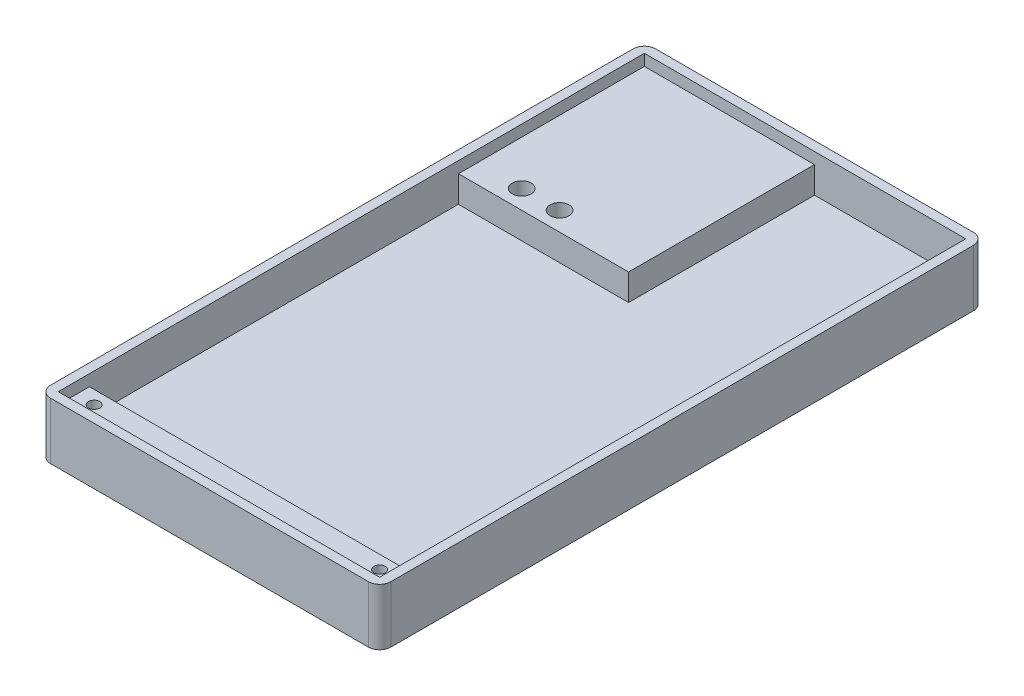
from build123d import *

# Parameters (mm, degrees)
SKETCH1_W           = 90
SKETCH1_H           = 160
BOSS_EXTRUDE1_DEPTH = 5
SKETCH2_W           = 90
SKETCH2_H           = 160
SKETCH2_W_2         = 85
SKETCH2_H_2         = 155
BOSS_EXTRUDE2_DEPTH = 10
SKETCH3_W           = 85
SKETCH3_H           = 8.25
SKETCH3_R           = 1.5
BOSS_EXTRUDE3_DEPTH = 7
SKETCH4_W           = 45
SKETCH4_H           = 39.175
SKETCH4_H_2         = 10
SKETCH4_R           = 2.5
BOSS_EXTRUDE4_DEPTH = 7
FILLET1_R           = 3
SKETCH5_R           = 2.5
SKETCH5_R_2         = 2.55926668
SKETCH5_R_3         = 1.5
CUT_EXTRUDE1_DEPTH  = 119.276665608


with BuildPart() as part:
    # Sketch1 → Boss-Extrude1 (new body)
    with BuildSketch(Plane(origin=(0, 0, 0), x_dir=(1, 0, 0), z_dir=(0, 1, 0))):
        with Locations((1.726862302, -28.194130926)):
            Rectangle(SKETCH1_W, SKETCH1_H)
    extrude(amount=BOSS_EXTRUDE1_DEPTH)

    # Sketch2 → Boss-Extrude2 (add)
    with BuildSketch(Plane(origin=(0, 5, 0), x_dir=(1, 0, 0), z_dir=(0, 1, 0))):
        with Locations((1.726862302, -28.194130926)):
            Rectangle(SKETCH2_W, SKETCH2_H)
        with Locations((1.726862302, -28.194130926)):
            Rectangle(SKETCH2_W_2, SKETCH2_H_2, mode=Mode.SUBTRACT)
    extrude(amount=BOSS_EXTRUDE2_DEPTH)

    # Sketch3 → Boss-Extrude3 (add)
    with BuildSketch(Plane(origin=(0, 5, 0), x_dir=(1, 0, 0), z_dir=(0, 1, 0))):
        with Locations((1.726862302, -101.569130926)):
            Rectangle(SKETCH3_W, SKETCH3_H)
        with Locations(Location((-36.023137698, -100.944130926, 0), (0, 0, 270))):
            Circle(SKETCH3_R, mode=Mode.SUBTRACT)
        with Locations(Location((39.476862302, -100.944130926, 0), (0, 0, 270))):
            Circle(SKETCH3_R, mode=Mode.SUBTRACT)
    extrude(amount=BOSS_EXTRUDE3_DEPTH)

    # Sketch4 → Boss-Extrude4 (add)
    # profile 1 of 2: a face of its own
    with BuildSketch(Plane(origin=(0, 5, 0), x_dir=(1, 0, 0), z_dir=(0, 1, 0))):
        with Locations((-18.273137698, 29.718369074)):
            Rectangle(SKETCH4_W, SKETCH4_H)
    # profile 2 of 2: a face of its own
    with BuildSketch(Plane(origin=(0, 5, 0), x_dir=(1, 0, 0), z_dir=(0, 1, 0))):
        with Locations((-18.273137698, 5.130869074)):
            Rectangle(SKETCH4_W, SKETCH4_H_2)
        with Locations(Location((-29.023137698, 5.130869074, 0), (0, 0, 90))):
            Circle(SKETCH4_R, mode=Mode.SUBTRACT)
        with Locations(Location((-19.023137698, 5.130869074, 0), (0, 0, 90))):
            Circle(SKETCH4_R, mode=Mode.SUBTRACT)
    extrude(amount=BOSS_EXTRUDE4_DEPTH)

    # Fillet1
    fillet1_edges = [part.edges().sort_by_distance(p)[0] for p in [
        (-43.273137698, 7.5, -51.805869074),
        (46.726862302, 7.5, -51.805869074),
        (46.726862302, 7.5, 108.194130926),
        (-43.273137698, 7.5, 108.194130926),
    ]]
    fillet(fillet1_edges, radius=FILLET1_R)

    # Sketch5 → Cut-Extrude1 (cut, through all)
    with BuildSketch(Plane(origin=(0, 5, 0), x_dir=(1, 0, 0), z_dir=(0, 1, 0))):
        with Locations(Location((-19.023137698, 5.130869074, 0), (0, 0, 90))):
            Circle(SKETCH5_R)
        with Locations(Location((-29.023137698, 5.130869074, 0), (0, 0, 270))):
            Circle(SKETCH5_R_2)
        with Locations(Location((-36.023137698, -100.944130926, 0), (0, 0, 270))):
            Circle(SKETCH5_R_3)
        with Locations(Location((39.476862302, -100.944130926, 0), (0, 0, 270))):
            Circle(SKETCH5_R_3)
    extrude(amount=-CUT_EXTRUDE1_DEPTH, mode=Mode.SUBTRACT)


solid = part.part
